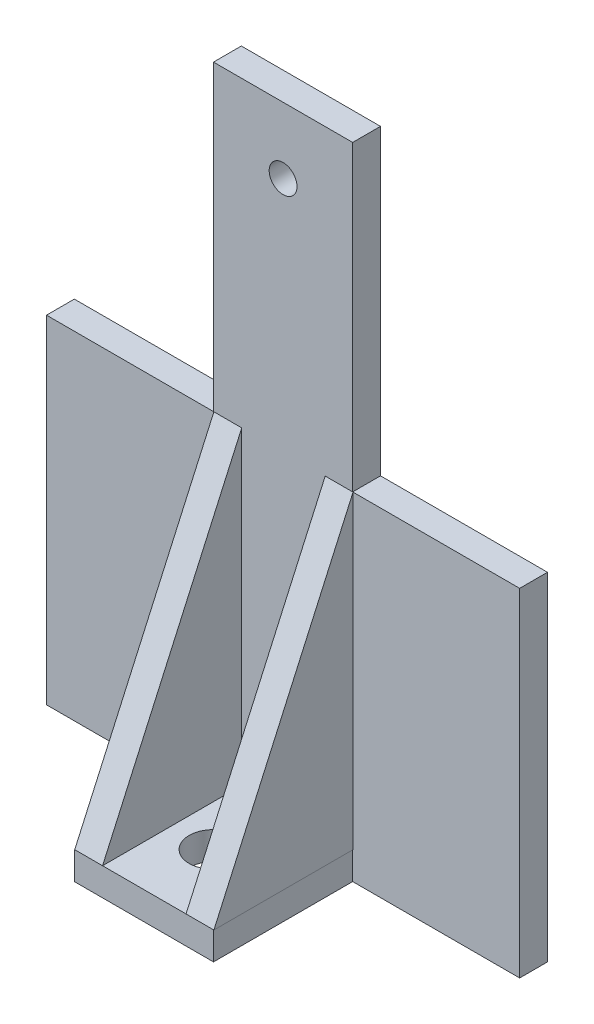
from build123d import *

# Parameters (mm, degrees)
ESBO_O1_R                = 1
RESSALTO_EXTRUS_O1_DEPTH = 2
ESBO_O2_W                = 34
ESBO_O2_H                = 2
RESSALTO_EXTRUS_O2_DEPTH = 10
ESBO_O3_R                = 1.75
CORTE_EXTRUS_O1_DEPTH    = 10
ESBO_O4_W                = 12.027176897
ESBO_O4_H                = 10
ESBO_O4_W_2              = 12
CORTE_EXTRUS_O2_DEPTH    = 10
RESSALTO_EXTRUS_O3_DEPTH = 10
ESBO_O6_W                = 6
ESBO_O6_H                = 22.25
CORTE_EXTRUS_O3_DEPTH    = 10


with BuildPart() as part:
    # Esboço1 → Ressalto-extrusão1 (new body)
    with BuildSketch(Plane.XY):
        Polygon((-17.425350174, 15.541666667), (-5.425350174, 15.541666667), (-5.425350174, 37.291666667), (4.574649826, 37.291666667), (4.574649826, 15.541666667), (16.574649826, 15.541666667), (16.574649826, -8.708333333), (-17.425350174, -8.708333333), align=None)
        with Locations((-0.425350174, 32.541666667)):
            Circle(ESBO_O1_R, mode=Mode.SUBTRACT)
        with Locations((-0.425350174, -3.958333333)):
            Circle(ESBO_O1_R, mode=Mode.SUBTRACT)
    extrude(amount=RESSALTO_EXTRUS_O1_DEPTH)

    # Esboço2 → Ressalto-extrusão2 (add)
    with BuildSketch(Plane.XY.offset(2)):
        with Locations((-0.425350174, -7.708333333)):
            Rectangle(ESBO_O2_W, ESBO_O2_H)
    extrude(amount=RESSALTO_EXTRUS_O2_DEPTH)

    # Esboço3 → Corte-extrusão1 (cut)
    with BuildSketch(Plane(origin=(0, -6.708333333, 0), x_dir=(1, 0, 0), z_dir=(0, 1, 0))):
        with Locations(Location((-0.425350174, -7, 0), (0, 0, 270))):
            Circle(ESBO_O3_R)
    extrude(amount=-CORTE_EXTRUS_O1_DEPTH, mode=Mode.SUBTRACT)

    # Esboço4 → Corte-extrusão2 (cut)
    with BuildSketch(Plane(origin=(0, -6.708333333, 0), x_dir=(1, 0, 0), z_dir=(0, 1, 0))):
        with Locations((-11.411761726, -7)):
            Rectangle(ESBO_O4_W, ESBO_O4_H)
        with Locations((10.574649826, -7)):
            Rectangle(ESBO_O4_W_2, ESBO_O4_H)
    extrude(amount=-CORTE_EXTRUS_O2_DEPTH, mode=Mode.SUBTRACT)

    # Esboço5 → Ressalto-extrusão3 (add)
    with BuildSketch(Plane.ZY.offset(5.398173277)):
        Polygon((12, -6.708333333), (2, 15.541666667), (2, -6.708333333), align=None)
    extrude(amount=-RESSALTO_EXTRUS_O3_DEPTH)

    # Esboço6 → Corte-extrusão3 (cut)
    with BuildSketch(Plane.XY.offset(12)):
        with Locations((-0.398173277, 4.416666667)):
            Rectangle(ESBO_O6_W, ESBO_O6_H)
    extrude(amount=-CORTE_EXTRUS_O3_DEPTH, mode=Mode.SUBTRACT)


solid = part.part
